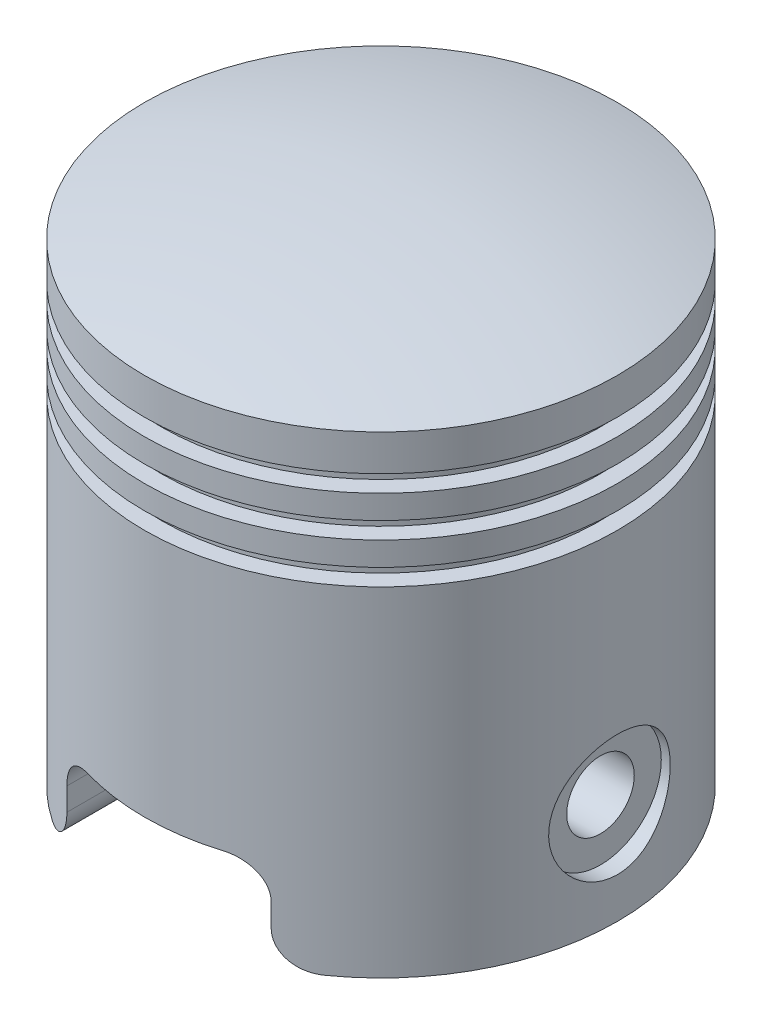
from build123d import *

# Parameters (mm, degrees)
SKETCH3_W           = 2.5
SKETCH3_H           = 2.5
LPATTERN2_COUNT     = 3
LPATTERN2_PITCH     = 6
SKETCH6_W           = 30
SKETCH6_H           = 13.374164213
CUT_EXTRUDE1_DEPTH  = 35
FILLET1_R           = 5
FILLET2_R           = 5
FILLET3_R           = 5
DOME1_FACE_RADIUS   = 35
DOME1_HEIGHT        = 5
SKETCH8_R           = 9
CUT_EXTRUDE2_DEPTH  = 2.5
SKETCH9_R           = 7.5
BOSS_EXTRUDE1_DEPTH = 32.5
SKETCH10_R          = 5
CUT_EXTRUDE3_DEPTH  = 32.5


with BuildPart() as part:
    # Sketch2 → Revolve1 (revolve)
    with BuildSketch(Plane.XY, mode=Mode.PRIVATE) as revolve1_sk:
        Polygon((0, 0), (0, -10), (23, -10), (23, -70), (35, -70), (35, 0), align=None)
    revolve(revolve1_sk.sketch.rotate(Axis((0, 0, 0), (0, -1, 0)), 90), axis=Axis((0, 0, 0), (0, -1, 0)))

    # Sketch3 → Cut-Revolve2 (revolve, cut)
    with BuildSketch(Plane.XY, mode=Mode.PRIVATE) as cut_revolve2_sk:
        with Locations((33.75, -6.610674558)):
            Rectangle(SKETCH3_W, SKETCH3_H)
    cut_revolve2 = revolve(cut_revolve2_sk.sketch.rotate(Axis((0, 0, 0), (0, -1, 0)), 90), axis=Axis((0, 0, 0), (0, -1, 0)), mode=Mode.SUBTRACT)

    # LPattern2: Cut-Revolve2 ×3
    with Locations(*[(0, -i * LPATTERN2_PITCH, 0) for i in range(1, LPATTERN2_COUNT)]):
        add(cut_revolve2, mode=Mode.SUBTRACT)

    # Sketch6 → Cut-Extrude1 (cut, symmetric)
    with BuildSketch(Plane.XY):
        with Locations((0.25670187, -63.312917893)):
            Rectangle(SKETCH6_W, SKETCH6_H)
    extrude(amount=CUT_EXTRUDE1_DEPTH, both=True, mode=Mode.SUBTRACT)

    # Fillet1
    fillet1_edges = [part.edges().sort_by_distance(p)[0] for p in [
        (-14.74329813, -56.625835787, 24.698230373),
    ]]
    fillet(fillet1_edges, radius=FILLET1_R)

    # Fillet2
    fillet2_edges = [part.edges().sort_by_distance(p)[0] for p in [
        (15.25670187, -56.625835787, 24.355576471),
        (-14.74329813, -56.625835787, -24.698230373),
        (15.25670187, -56.625835787, -24.355576471),
    ]]
    fillet(fillet2_edges, radius=FILLET2_R)

    # Fillet3
    fillet3_edges = [part.edges().sort_by_distance(p)[0] for p in [
        (15.25670187, -70, 24.355576471),
        (-14.74329813, -70, 24.698230373),
        (15.25670187, -70, -24.355576471),
        (-14.74329813, -70, -24.698230373),
    ]]
    fillet(fillet3_edges, radius=FILLET3_R)

    # Dome1: a dome of height H over a round flat face of radius A is a cap of a sphere of radius (A * A + H * H) / (2 * H)
    dome1_r = (DOME1_FACE_RADIUS * DOME1_FACE_RADIUS + DOME1_HEIGHT * DOME1_HEIGHT) / (2 * DOME1_HEIGHT)
    dome1_base = Plane((0, 0, 0), z_dir=(0, 1, 0))
    with Locations(dome1_base.offset(DOME1_HEIGHT - dome1_r)):
        dome1_ball = Sphere(dome1_r, mode=Mode.PRIVATE)
    add(split(dome1_ball, bisect_by=dome1_base, keep=Keep.TOP, mode=Mode.PRIVATE))

    # Sketch8 → Cut-Extrude2 (cut)
    with BuildSketch(Plane(origin=(35, 0, 0), x_dir=(0, 0, -1), z_dir=(1, 0, 0))):
        with Locations((0, -55)):
            Circle(SKETCH8_R)
    cut_extrude2 = extrude(amount=-CUT_EXTRUDE2_DEPTH, mode=Mode.SUBTRACT)

    # Mirror1: Cut-Extrude2 across plane
    add(cut_extrude2.mirror(Plane(origin=(0, 0, 0), x_dir=(0, 0, 1), z_dir=(1, 0, 0))), mode=Mode.SUBTRACT)

    # Sketch9 → Boss-Extrude1 (add, symmetric)
    with BuildSketch(Plane(origin=(0, 0, 0), x_dir=(0, 0, -1), z_dir=(1, 0, 0))):
        with Locations(Location((0, -55, 0), (0, 0, 180))):
            Circle(SKETCH9_R)
    extrude(amount=BOSS_EXTRUDE1_DEPTH, both=True)

    # Sketch10 → Cut-Extrude3 (cut, symmetric)
    with BuildSketch(Plane(origin=(0, 0, 0), x_dir=(0, 0, -1), z_dir=(1, 0, 0))):
        with Locations((0, -55)):
            Circle(SKETCH10_R)
    extrude(amount=CUT_EXTRUDE3_DEPTH, both=True, mode=Mode.SUBTRACT)


solid = part.part
